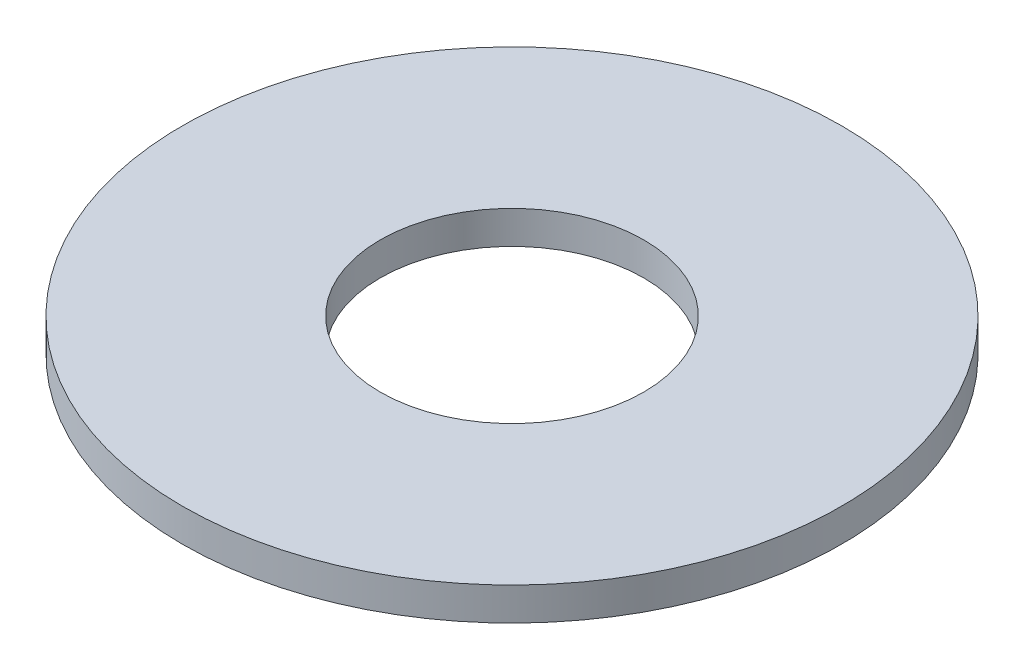
from build123d import *

# Parameters (mm, degrees)
SKETCH1_R           = 10
SKETCH1_R_2         = 4
BOSS_EXTRUDE1_DEPTH = 1


with BuildPart() as part:
    # Sketch1 → Boss-Extrude1 (new body)
    with BuildSketch(Plane(origin=(0, 0, 0), x_dir=(1, 0, 0), z_dir=(0, 1, 0))):
        with Locations(Location((0, 0, 0), (0, 0, 270))):
            Circle(SKETCH1_R)
        with Locations(Location((0, 0, 0), (0, 0, 270))):
            Circle(SKETCH1_R_2, mode=Mode.SUBTRACT)
    extrude(amount=BOSS_EXTRUDE1_DEPTH)


solid = part.part
